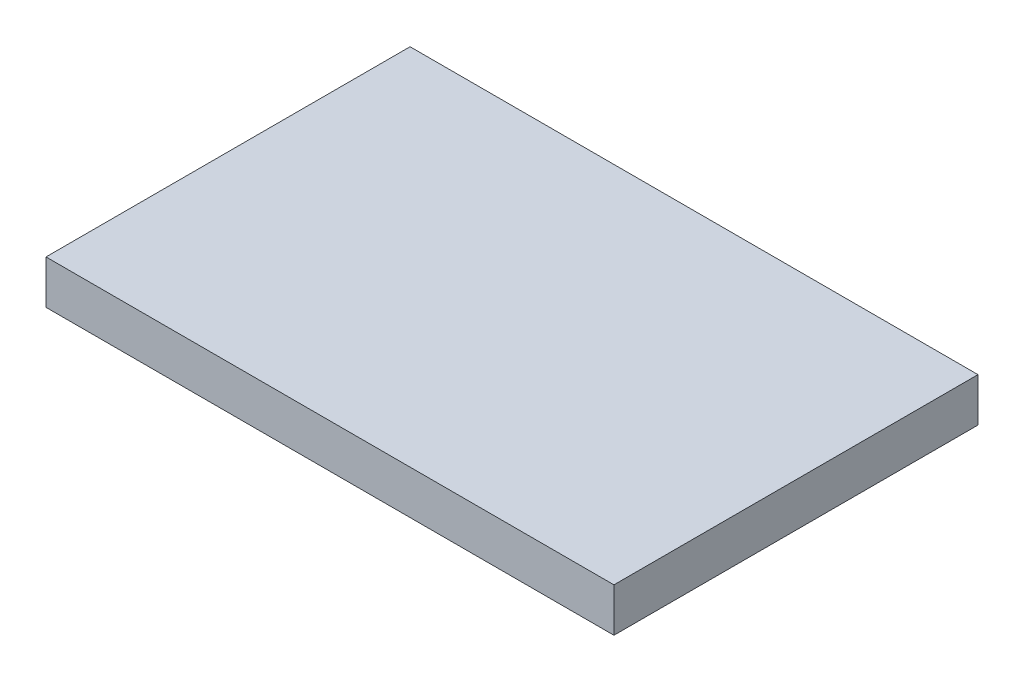
from build123d import *

# Parameters (mm, degrees)
SKETCH1_W           = 390
SKETCH1_H           = 250
BOSS_EXTRUDE1_DEPTH = 30


with BuildPart() as part:
    # Sketch1 → Boss-Extrude1 (new body)
    with BuildSketch(Plane(origin=(0, 0, 0), x_dir=(1, 0, 0), z_dir=(0, 1, 0))):
        Rectangle(SKETCH1_W, SKETCH1_H)
    extrude(amount=BOSS_EXTRUDE1_DEPTH)


solid = part.part
